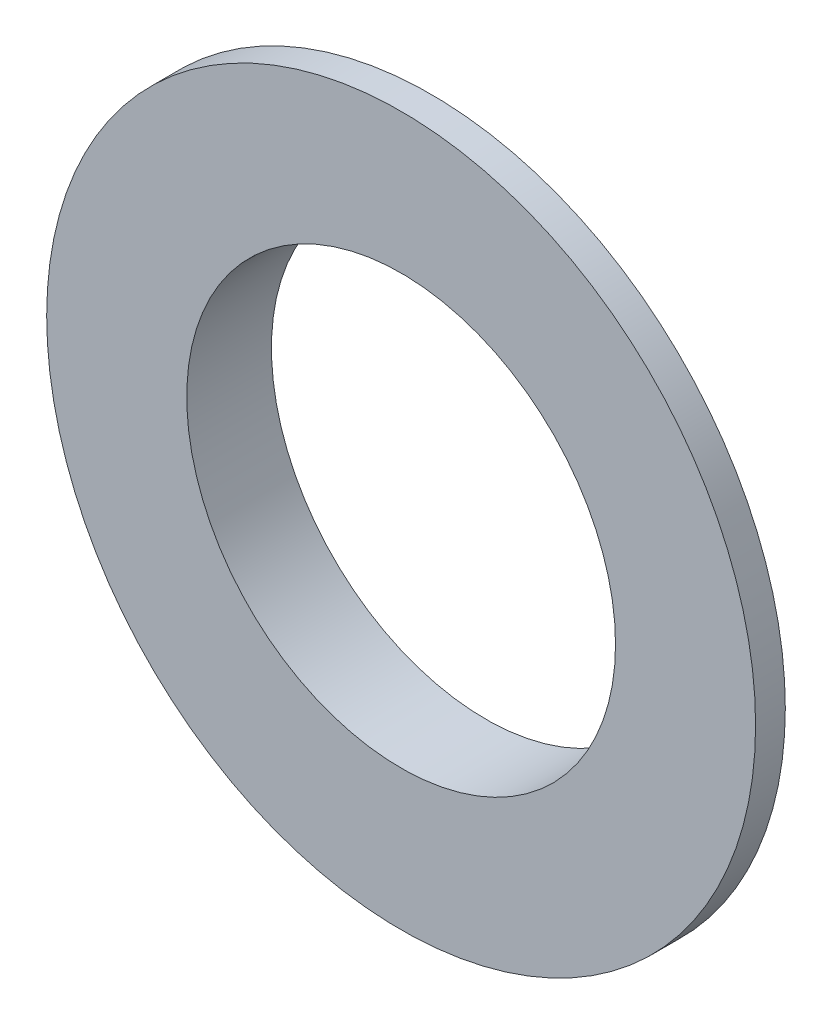
from build123d import *

# Parameters (mm, degrees)
SKETCH1_R           = 7.5375
SKETCH1_R_2         = 5.95
BOSS_EXTRUDE1_DEPTH = 1.525
SKETCH2_R           = 9.8375
SKETCH2_R_2         = 5.95
BOSS_EXTRUDE2_DEPTH = 0.825


with BuildPart() as part:
    # Sketch1 → Boss-Extrude1 (new body)
    with BuildSketch(Plane.XY):
        Circle(SKETCH1_R)
        Circle(SKETCH1_R_2, mode=Mode.SUBTRACT)
    extrude(amount=BOSS_EXTRUDE1_DEPTH)

    # Sketch2 → Boss-Extrude2 (add)
    with BuildSketch(Plane.XY.offset(1.525)):
        Circle(SKETCH2_R)
        Circle(SKETCH2_R_2, mode=Mode.SUBTRACT)
    extrude(amount=BOSS_EXTRUDE2_DEPTH)


solid = part.part
